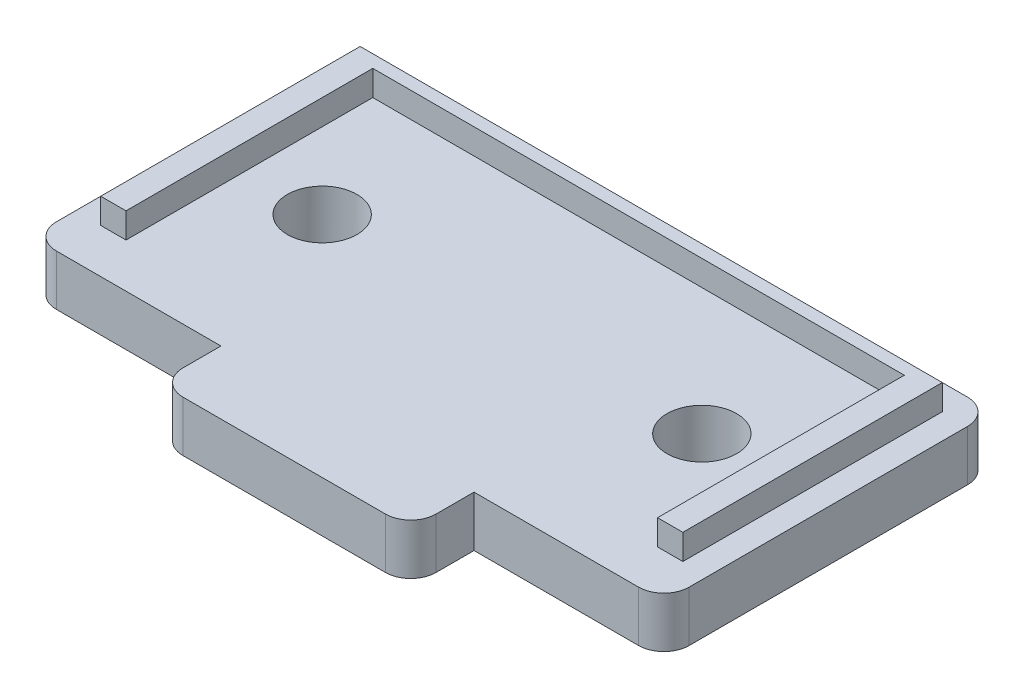
from build123d import *

# Parameters (mm, degrees)
EXTRUDE_1_DEPTH     = 4
FILLET_1_R          = 2
CUT_EXTRUDE_1_REACH = 33.064
SKETCH_3_R          = 2.75
EXTRUDE_2_DEPTH     = 2


with BuildPart() as part:
    # 草图1 → 凸台-拉伸1 (new body)
    with BuildSketch(Plane(origin=(0, 0, 0), x_dir=(1, 0, 0), z_dir=(0, 1, 0))):
        Polygon((-25, 13), (25, 13), (25, -13), (10, -13), (10, -18), (-10, -18), (-10, -13), (-25, -13), align=None)
    extrude(amount=EXTRUDE_1_DEPTH)

    # 圆角1
    fillet_1_edges = [part.edges().sort_by_distance(p)[0] for p in [
        (10, 2, 18),
        (-10, 2, 18),
        (-25, 2, 13),
        (-25, 2, -13),
        (25, 2, -13),
        (25, 2, 13),
    ]]
    fillet(fillet_1_edges, radius=FILLET_1_R)

    # 草图3 → 切除-拉伸1 (cut, up to next)
    with BuildSketch(Plane(origin=(0, 4, 0), x_dir=(1, 0, 0), z_dir=(0, 1, 0)), mode=Mode.PRIVATE) as cut_extrude_1_sk1:
        with Locations(Location((-15, 0, 0), (0, 0, 270))):
            Circle(SKETCH_3_R)
    cut_extrude_1_tool1 = extrude(cut_extrude_1_sk1.sketch, amount=-CUT_EXTRUDE_1_REACH, mode=Mode.PRIVATE) & part.part
    # 草图3 → 切除-拉伸1 (cut, up to next)
    with BuildSketch(Plane(origin=(0, 4, 0), x_dir=(1, 0, 0), z_dir=(0, 1, 0)), mode=Mode.PRIVATE) as cut_extrude_1_sk2:
        with Locations(Location((15, 0, 0), (0, 0, 90))):
            Circle(SKETCH_3_R)
    cut_extrude_1_tool2 = extrude(cut_extrude_1_sk2.sketch, amount=-CUT_EXTRUDE_1_REACH, mode=Mode.PRIVATE) & part.part
    add(cut_extrude_1_tool1.solids().sort_by_distance((-15, 4, 0))[0], mode=Mode.SUBTRACT)
    add(cut_extrude_1_tool2.solids().sort_by_distance((15, 4, 0))[0], mode=Mode.SUBTRACT)

    # 草图4 → 凸台-拉伸2 (add)
    with BuildSketch(Plane(origin=(0, 4, 0), x_dir=(1, 0, 0), z_dir=(0, 1, 0))):
        Polygon((21, -9.5), (21, 9.5), (21, 10), (-8.5, 10), (-20.5, 10), (-21, 10), (-21, 9.5), (-21, -9.5), (-23, -9.5), (-23, 11), (23, 11), (23, -9.5), align=None)
    extrude(amount=EXTRUDE_2_DEPTH)


solid = part.part
